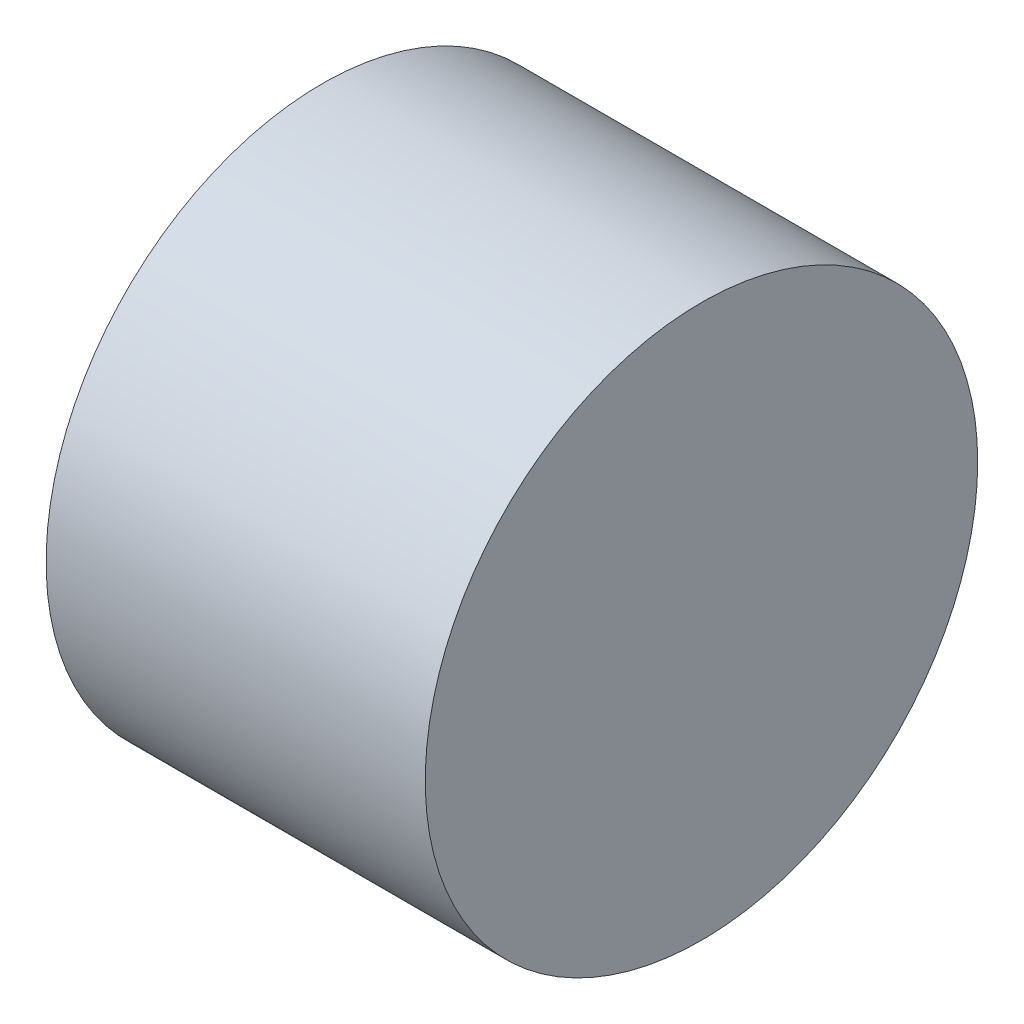
from build123d import *

# Parameters (mm, degrees)
SKETCH2_R           = 25.5
BOSS_EXTRUDE1_DEPTH = 35


with BuildPart() as part:
    # Sketch2 → Boss-Extrude1 (new body)
    with BuildSketch(Plane(origin=(0, 0, 0), x_dir=(0, 0, -1), z_dir=(1, 0, 0))):
        Circle(SKETCH2_R)
    extrude(amount=BOSS_EXTRUDE1_DEPTH)


solid = part.part
